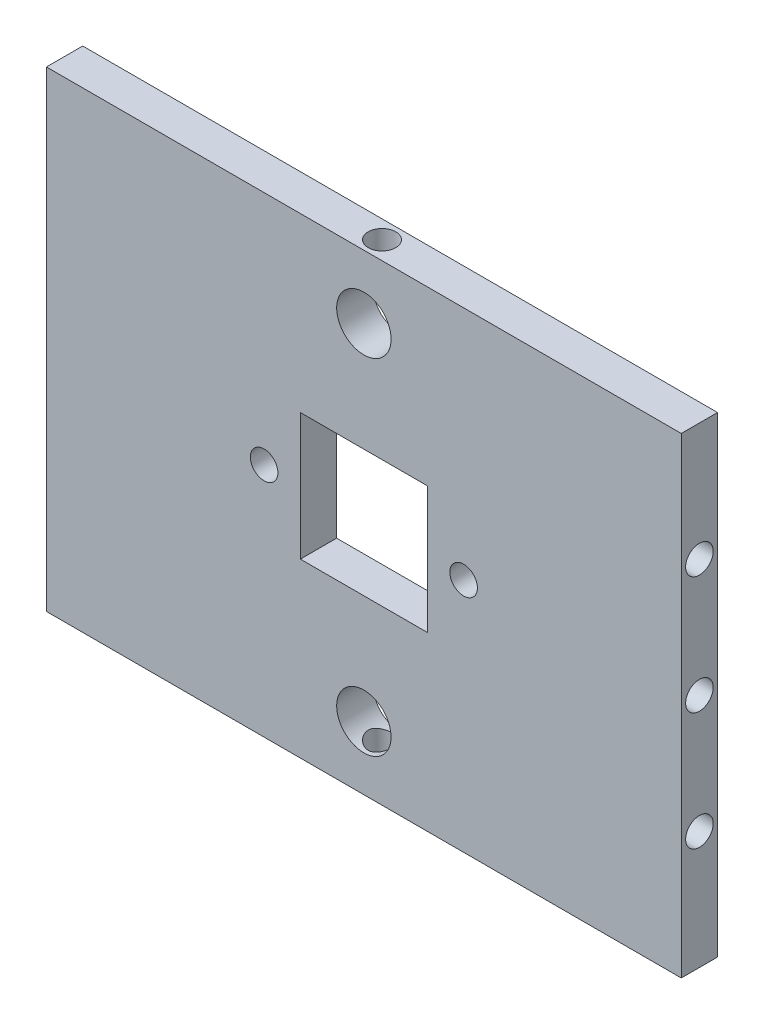
from build123d import *

# Parameters (mm, degrees)
SKETCH1_W           = 111.125
SKETCH1_H           = 82.55
SKETCH1_R           = 4.7625
BOSS_EXTRUDE1_DEPTH = 6.35
SKETCH2_R           = 2.413
CUT_EXTRUDE1_DEPTH  = 12.7
SKETCH3_R           = 2.413
CUT_EXTRUDE2_DEPTH  = 12.7
SKETCH4_R           = 2.413
SKETCH4_W           = 22.225
SKETCH4_H           = 22.225
CUT_EXTRUDE3_DEPTH  = 7.62


with BuildPart() as part:
    # Sketch1 → Boss-Extrude1 (new body)
    with BuildSketch(Plane.XY):
        Rectangle(SKETCH1_W, SKETCH1_H)
        with Locations((0, 30.1625)):
            Circle(SKETCH1_R, mode=Mode.SUBTRACT)
        with Locations(Location((0, -30.1625, 0), (0, 0, 180))):
            Circle(SKETCH1_R, mode=Mode.SUBTRACT)
    extrude(amount=BOSS_EXTRUDE1_DEPTH)

    # Sketch2 → Cut-Extrude1 (cut)
    with BuildSketch(Plane(origin=(55.5625, 0, 0), x_dir=(0, 0, -1), z_dir=(1, 0, 0))):
        with Locations((-3.175, 20.6375)):
            Circle(SKETCH2_R)
        with Locations((-3.175, 0)):
            Circle(SKETCH2_R)
        with Locations((-3.175, -20.6375)):
            Circle(SKETCH2_R)
    cut_extrude1 = extrude(amount=-CUT_EXTRUDE1_DEPTH, mode=Mode.SUBTRACT)

    # Mirror1: Cut-Extrude1 across plane
    add(cut_extrude1.mirror(Plane(origin=(0, 0, 0), x_dir=(0, 0, 1), z_dir=(1, 0, 0))), mode=Mode.SUBTRACT)

    # Sketch3 → Cut-Extrude2 (cut)
    with BuildSketch(Plane(origin=(0, 41.275, 0), x_dir=(1, 0, 0), z_dir=(0, 1, 0))):
        with Locations(Location((0, -3.175, 0), (0, 0, 180))):
            Circle(SKETCH3_R)
    cut_extrude2 = extrude(amount=-CUT_EXTRUDE2_DEPTH, mode=Mode.SUBTRACT)

    # Mirror2: Cut-Extrude2 across plane
    add(cut_extrude2.mirror(Plane.ZX), mode=Mode.SUBTRACT)

    # Sketch4 → Cut-Extrude3 (cut)
    with BuildSketch(Plane.XY.offset(6.35)):
        with Locations((17.4625, 0)):
            Circle(SKETCH4_R)
        with Locations((-17.4625, 0)):
            Circle(SKETCH4_R)
        Rectangle(SKETCH4_W, SKETCH4_H)
    extrude(amount=-CUT_EXTRUDE3_DEPTH, mode=Mode.SUBTRACT)


solid = part.part
